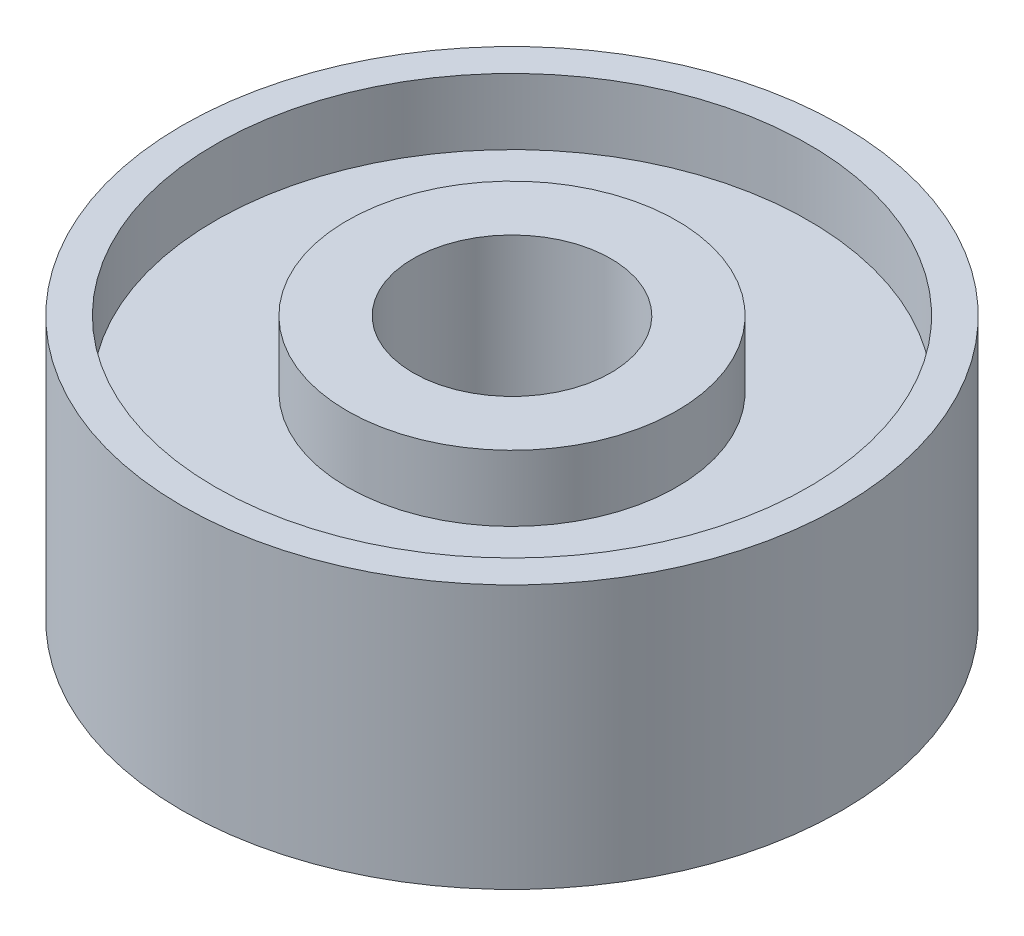
from build123d import *

# Parameters (mm, degrees)
SKETCH_1_R          = 5
SKETCH_1_R_2        = 1.5
EXTRUDE_1_DEPTH     = 4
SKETCH_2_R          = 4.5
SKETCH_2_R_2        = 2.5
CUT_EXTRUDE_1_DEPTH = 1
CUT_EXTRUDE_START   = -1
SKETCH_3_R          = 4.5
SKETCH_3_R_2        = 2.5
CUT_EXTRUDE_2_DEPTH = 1


with BuildPart() as part:
    # Эскиз1 → Бобышка-Вытянуть1 (new body)
    with BuildSketch(Plane(origin=(0, 0, 0), x_dir=(1, 0, 0), z_dir=(0, 1, 0))):
        with Locations(Location((0, 0, 0), (0, 0, 270))):
            Circle(SKETCH_1_R)
        with Locations(Location((0, 0, 0), (0, 0, 270))):
            Circle(SKETCH_1_R_2, mode=Mode.SUBTRACT)
    extrude(amount=EXTRUDE_1_DEPTH)

    # Эскиз2 → Вырез-Вытянуть1 (cut)
    with BuildSketch(Plane(origin=(0, 4, 0), x_dir=(1, 0, 0), z_dir=(0, 1, 0))):
        with Locations(Location((0, 0, 0), (0, 0, 270))):
            Circle(SKETCH_2_R)
        with Locations(Location((0, 0, 0), (0, 0, 270))):
            Circle(SKETCH_2_R_2, mode=Mode.SUBTRACT)
    extrude(amount=-CUT_EXTRUDE_1_DEPTH, mode=Mode.SUBTRACT)

    # Эскиз3 → Вырез-Вытянуть2 (cut)
    with BuildSketch(Plane.XZ.offset(CUT_EXTRUDE_START)):
        with Locations(Location((0, 0, 0), (0, 0, 90))):
            Circle(SKETCH_3_R)
        with Locations(Location((0, 0, 0), (0, 0, 90))):
            Circle(SKETCH_3_R_2, mode=Mode.SUBTRACT)
    extrude(amount=CUT_EXTRUDE_2_DEPTH, mode=Mode.SUBTRACT)


solid = part.part
